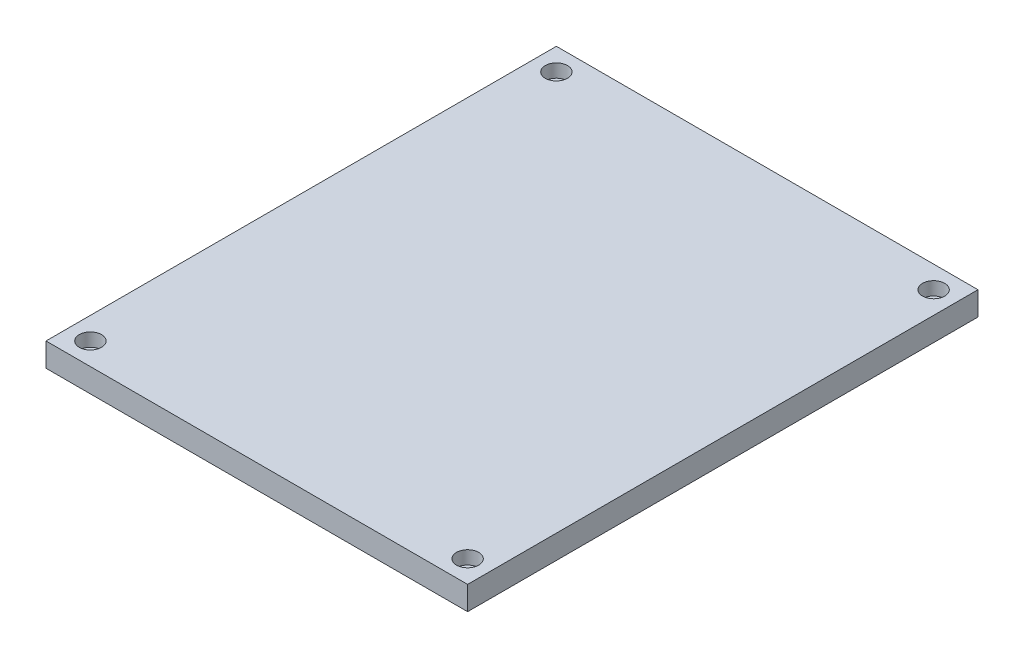
from build123d import *

# Parameters (mm, degrees)
SKETCH1_W               = 142.5
SKETCH1_H               = 172.5
BOSS_EXTRUDE1_DEPTH     = 4
CUT_EXTRUDE1_DEPTH      = 224.889481665
CUT_EXTRUDE1_DEPTH_BACK = 224.889481665
SKETCH2_R               = 2.25
CUT_EXTRUDE2_DEPTH      = 224.889481665
CUT_EXTRUDE2_DEPTH_BACK = 4.5
SKETCH3_R               = 3.75


with BuildPart() as part:
    # Sketch1 → Boss-Extrude1 (new, symmetric)
    with BuildSketch(Plane(origin=(0, 0, 0), x_dir=(1, 0, 0), z_dir=(0, 1, 0))):
        with Locations((71.25, 86.25)):
            Rectangle(SKETCH1_W, SKETCH1_H)
    extrude(amount=BOSS_EXTRUDE1_DEPTH, both=True)

    # Sketch2 → Cut-Extrude1 (cut, two sides: drawn at the far end of the back side and taken through both)
    with BuildSketch(Plane(origin=(0, 4, 0), x_dir=(1, 0, 0), z_dir=(0, 1, 0)).offset(-CUT_EXTRUDE1_DEPTH_BACK)):
        with Locations(Location((7.5, 165, 0), (0, 0, 270))):
            Circle(SKETCH2_R)
        with Locations(Location((135, 165, 0), (0, 0, 270))):
            Circle(SKETCH2_R)
        with Locations(Location((135, 7.5, 0), (0, 0, 270))):
            Circle(SKETCH2_R)
        with Locations(Location((7.5, 7.5, 0), (0, 0, 270))):
            Circle(SKETCH2_R)
    extrude(amount=CUT_EXTRUDE1_DEPTH + CUT_EXTRUDE1_DEPTH_BACK, mode=Mode.SUBTRACT)

    # Sketch3 → Cut-Extrude2 (cut, two sides: drawn at the far end of the back side and taken through both)
    with BuildSketch(Plane(origin=(0, 4, 0), x_dir=(1, 0, 0), z_dir=(0, 1, 0)).offset(-CUT_EXTRUDE2_DEPTH_BACK)):
        with Locations(Location((7.5, 165, 0), (0, 0, 90))):
            Circle(SKETCH3_R)
        with Locations(Location((135, 165, 0), (0, 0, 90))):
            Circle(SKETCH3_R)
        with Locations(Location((135, 7.5, 0), (0, 0, 90))):
            Circle(SKETCH3_R)
        with Locations(Location((7.5, 7.5, 0), (0, 0, 90))):
            Circle(SKETCH3_R)
    extrude(amount=CUT_EXTRUDE2_DEPTH + CUT_EXTRUDE2_DEPTH_BACK, mode=Mode.SUBTRACT)


solid = part.part
